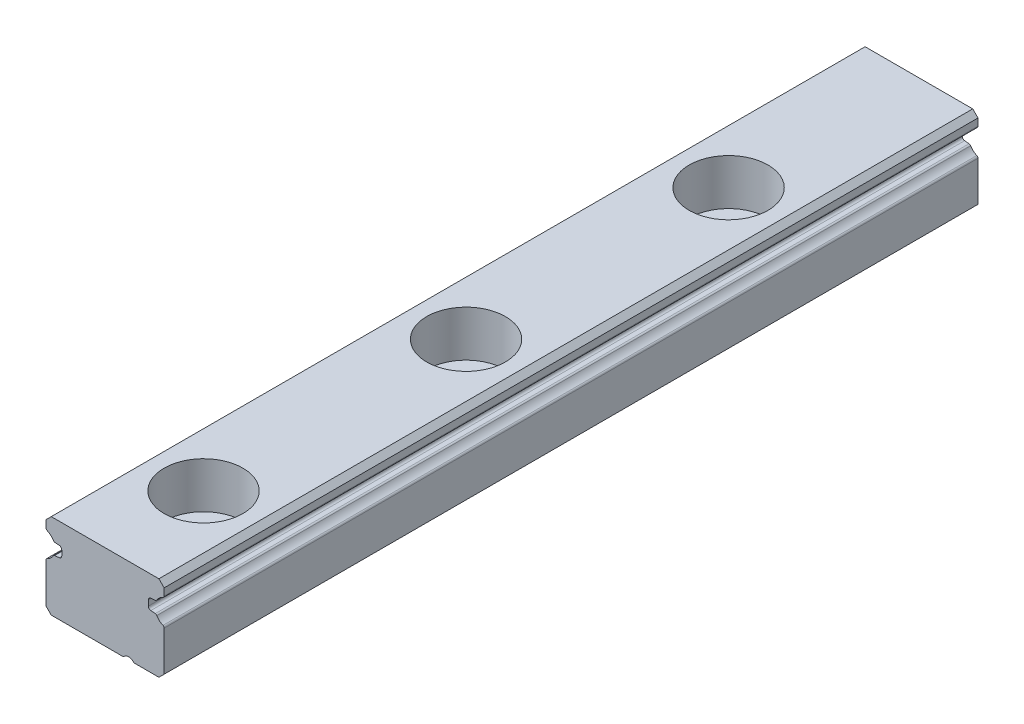
from build123d import *

# Parameters (mm, degrees)
BOSS_EXTRUDE1_START = 31
BOSS_EXTRUDE1_DEPTH = 62
LPATTERN1_COUNT     = 3
LPATTERN1_PITCH     = 20


with BuildPart() as part:
    # Sketch3 → Boss-Extrude1 (new body)
    with BuildSketch(Plane.XY.offset(BOSS_EXTRUDE1_START)):
        with BuildLine():
            Line((-4.5, 0.191696476), (-4.5, -2.85))
            Line((-4.5, -2.85), (-4.1, -3.25))
            Line((-4.1, -3.25), (1.4, -3.25))
            ThreePointArc((1.4, -3.25), (1.8, -3.05), (2.2, -3.25))
            Line((2.2, -3.25), (4.1, -3.25))
            Line((4.1, -3.25), (4.5, -2.85))
            Line((4.5, -2.85), (4.5, 0.191696476))
            ThreePointArc((4.5, 0.191696476), (4.475108648, 0.274448068), (4.408695652, 0.329735674))
            ThreePointArc((4.408695652, 0.329735674), (4.141262777, 0.497623907), (3.939510483, 0.740528855))
            ThreePointArc((3.939510483, 0.740528855), (3.890337026, 0.791057421), (3.823510417, 0.813537838))
            Line((3.823510417, 0.813537838), (3.482568852, 0.84336636))
            ThreePointArc((3.482568852, 0.84336636), (3.352544533, 0.907487258), (3.3, 1.042605299))
            Line((3.3, 1.042605299), (3.3, 1.457394701))
            ThreePointArc((3.3, 1.457394701), (3.352544533, 1.592512742), (3.482568852, 1.65663364))
            Line((3.482568852, 1.65663364), (3.823514163, 1.68646249))
            ThreePointArc((3.823514163, 1.68646249), (3.890340367, 1.708942652), (3.939513741, 1.759470648))
            ThreePointArc((3.939513741, 1.759470648), (4.141265182, 2.002372199), (4.408695652, 2.170258326))
            ThreePointArc((4.408695652, 2.170258326), (4.475108648, 2.225545932), (4.5, 2.308297524))
            Line((4.5, 2.308297524), (4.5, 2.85))
            Line((4.5, 2.85), (4.1, 3.25))
            Line((4.1, 3.25), (-4.1, 3.25))
            Line((-4.1, 3.25), (-4.5, 2.85))
            Line((-4.5, 2.85), (-4.5, 2.308297524))
            ThreePointArc((-4.5, 2.308297524), (-4.475108648, 2.225545932), (-4.408695652, 2.170258326))
            ThreePointArc((-4.408695652, 2.170258326), (-4.141265182, 2.002372199), (-3.939513741, 1.759470648))
            ThreePointArc((-3.939513741, 1.759470648), (-3.890340367, 1.708942652), (-3.823514163, 1.68646249))
            Line((-3.823514163, 1.68646249), (-3.482568852, 1.65663364))
            ThreePointArc((-3.482568852, 1.65663364), (-3.352544533, 1.592512742), (-3.3, 1.457394701))
            Line((-3.3, 1.457394701), (-3.3, 1.042605299))
            ThreePointArc((-3.3, 1.042605299), (-3.352544533, 0.907487258), (-3.482568852, 0.84336636))
            Line((-3.482568852, 0.84336636), (-3.823510417, 0.813537838))
            ThreePointArc((-3.823510417, 0.813537838), (-3.890337026, 0.791057421), (-3.939510483, 0.740528855))
            ThreePointArc((-3.939510483, 0.740528855), (-4.141262777, 0.497623907), (-4.408695652, 0.329735674))
            ThreePointArc((-4.408695652, 0.329735674), (-4.475108648, 0.274448068), (-4.5, 0.191696476))
        make_face()
    extrude(amount=-BOSS_EXTRUDE1_DEPTH)

    # Sketch4 → Cut-Revolve1 (revolve, cut)
    with BuildSketch(Plane.XY.offset(23.5)):
        Polygon((0, 3.25), (0, -3.25), (-1.75, -3.25), (-1.75, -0.25), (-3, -0.25), (-3, 3.25), align=None)
    cut_revolve1 = revolve(axis=Axis((0, 3.25, 23.5), (0, -1, 0)), mode=Mode.SUBTRACT)

    # LPattern1: Cut-Revolve1 ×3
    with Locations(*[(0, 0, -i * LPATTERN1_PITCH) for i in range(1, LPATTERN1_COUNT)]):
        add(cut_revolve1, mode=Mode.SUBTRACT)


solid = part.part
